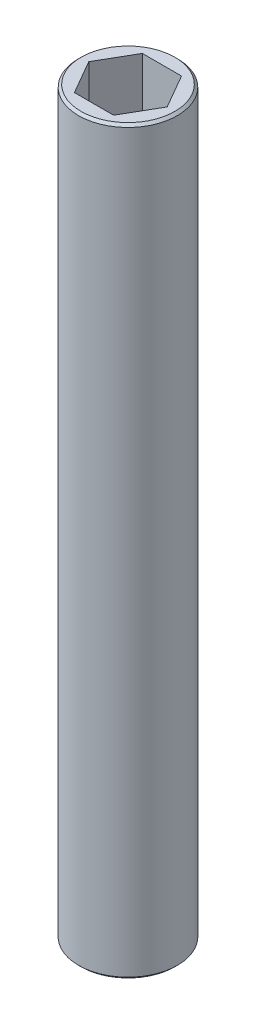
from build123d import *

# Parameters (mm, degrees)
SKETCH1_R           = 4
BOSS_EXTRUDE2_DEPTH = 60
CHAMFER1_SIZE       = 0.2


with BuildPart() as part:
    # Sketch1 → Boss-Extrude2 (new body)
    with BuildSketch(Plane(origin=(0, 0, 0), x_dir=(1, 0, 0), z_dir=(0, 1, 0))):
        with Locations(Location((0, 0, 0), (0, 0, 270))):
            Circle(SKETCH1_R)
        Polygon((3.175, 0), (1.5875, 2.749630657), (-1.5875, 2.749630657), (-3.175, 0), (-1.5875, -2.749630657), (1.5875, -2.749630657), align=None, mode=Mode.SUBTRACT)
    extrude(amount=BOSS_EXTRUDE2_DEPTH)

    # Chamfer1
    chamfer1_edges = [part.edges().sort_by_distance(p)[0] for p in [
        (0, 0, -4),
        (0, 60, -4),
    ]]
    chamfer(chamfer1_edges, length=CHAMFER1_SIZE)


solid = part.part
